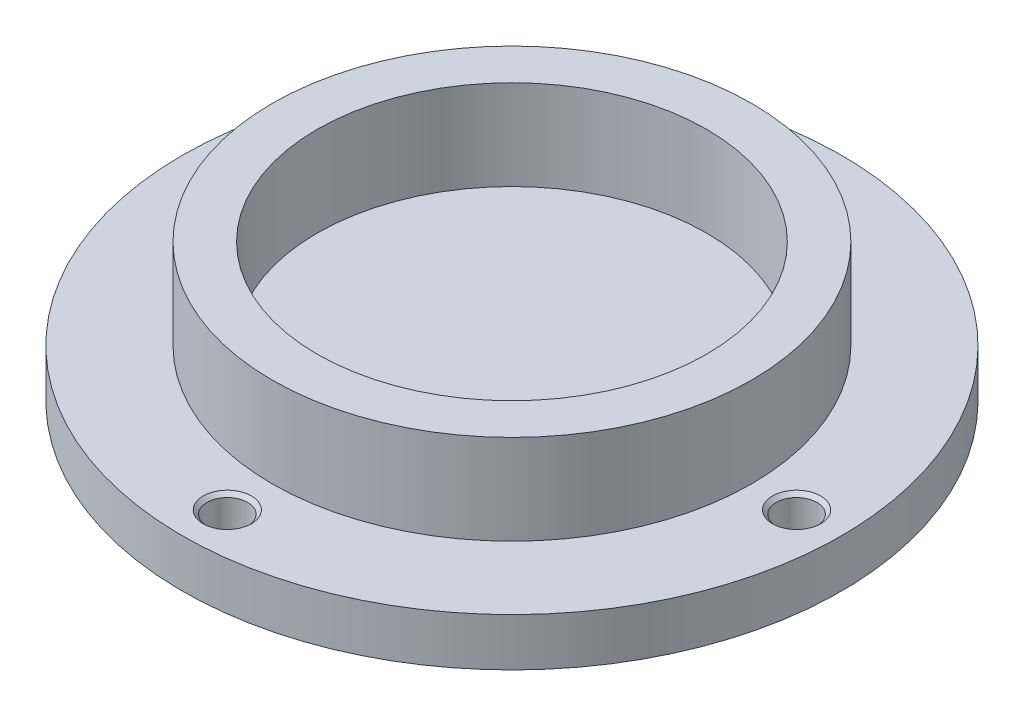
from build123d import *

# Parameters (mm, degrees)
HOLE_WIZARD_M8_1_D           = 6.8
HOLE_WIZARD_M8_1_CSINK_D     = 8.05
HOLE_WIZARD_M8_1_CSINK_ANGLE = 90


with BuildPart() as part:
    # 草图1 → 旋转1 (revolve)
    with BuildSketch(Plane.XY, mode=Mode.PRIVATE) as revolve_1_sk:
        Polygon((0, 0), (55, 0), (55, 8), (40, 8), (40, 23), (32.5, 23), (32.5, 8), (0, 8), align=None)
    revolve(revolve_1_sk.sketch.rotate(Axis((0, 8, 0), (0, -1, 0)), 180), axis=Axis((0, 8, 0), (0, -1, 0)))

    # M8 螺纹孔1 (through all)
    with Locations(Plane(origin=(0, 8, 0), x_dir=(1, 0, 0), z_dir=(0, 1, 0))):
        with Locations((-47.5, 0), (47.5, 0), (0, -47.5), (0, 47.5)):
            CounterSinkHole(HOLE_WIZARD_M8_1_D / 2, HOLE_WIZARD_M8_1_CSINK_D / 2, counter_sink_angle=HOLE_WIZARD_M8_1_CSINK_ANGLE)


solid = part.part
